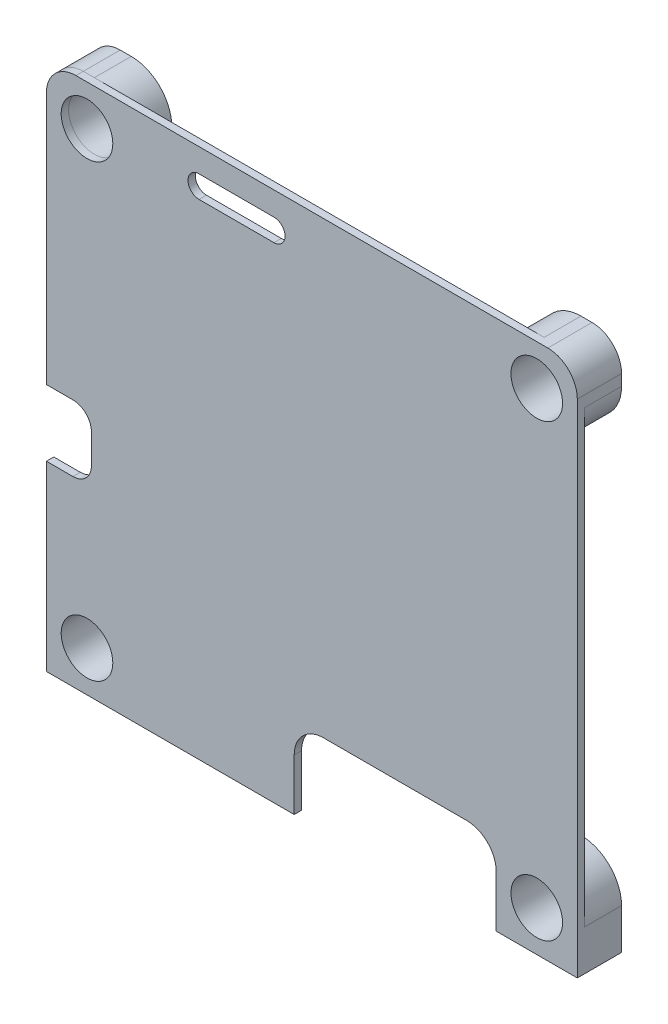
from build123d import *

# Parameters (mm, degrees)
SKETCH2_R         = 1.75
STANDOFFS_DEPTH   = 2.5
STANDOFFS_2_DEPTH = 2.5
STANDOFFS_3_DEPTH = 2.5
STANDOFFS_4_DEPTH = 2.5
SKETCH3_R         = 1.75
COVER_DEPTH       = 0.5
FILLETS_R         = 2


with BuildPart() as part:
    # Sketch2 → Standoffs (new body)
    with BuildSketch(Plane.XY):
        with BuildLine():
            Line((18, -18), (18, -15.25))
            ThreePointArc((18, -15.25), (15.25, -12.5), (12.5, -15.25))
            Line((12.5, -15.25), (12.5, -18))
            Line((12.5, -18), (18, -18))
        make_face()
        with Locations((15.25, -15.25)):
            Circle(SKETCH2_R, mode=Mode.SUBTRACT)
    extrude(amount=STANDOFFS_DEPTH)



with BuildPart() as body_2:
    # Sketch2 → Standoffs 2 (new body)
    with BuildSketch(Plane.XY):
        with BuildLine():
            Line((-12.5, -18), (-12.5, -15.25))
            ThreePointArc((-12.5, -15.25), (-15.250000002, -12.5), (-18, -15.250000004))
            Line((-18, -15.250000004), (-18, -18))
            Line((-18, -18), (-12.5, -18))
        make_face()
        with Locations((-15.25, -15.25)):
            Circle(SKETCH2_R, mode=Mode.SUBTRACT)
    extrude(amount=STANDOFFS_2_DEPTH)


with BuildPart() as body_3:
    # Sketch2 → Standoffs 3 (new body)
    with BuildSketch(Plane.XY):
        with BuildLine():
            Line((16, 18), (15.25, 18))
            ThreePointArc((15.25, 18), (13.305456352, 13.305456352), (18, 15.25))
            Line((18, 15.25), (18, 16))
            ThreePointArc((18, 16), (17.414213562, 17.414213562), (16, 18))
        make_face()
        with Locations((15.25, 15.25)):
            Circle(SKETCH2_R, mode=Mode.SUBTRACT)
    extrude(amount=STANDOFFS_3_DEPTH)


with BuildPart() as body_4:
    # Sketch2 → Standoffs 4 (new body)
    with BuildSketch(Plane.XY):
        with BuildLine():
            Line((-18, 16), (-18, 15.25))
            ThreePointArc((-18, 15.25), (-13.305456377, 13.305456326), (-15.249999928, 18))
            Line((-15.249999928, 18), (-16, 18))
            ThreePointArc((-16, 18), (-17.414213562, 17.414213562), (-18, 16))
        make_face()
        with Locations((-15.25, 15.25)):
            Circle(SKETCH2_R, mode=Mode.SUBTRACT)
    extrude(amount=STANDOFFS_4_DEPTH)


with BuildPart() as part_1:
    add(part.part)

    add(body_3.part)  # Cover merges body 3

    add(body_2.part)  # Cover merges body 2
    # Sketch3 → Cover (add)
    with BuildSketch(Plane.XY.offset(2.5)):
        with BuildLine():
            Line((-18, -5.65), (-18, -18))
            Line((-18, -18), (-1.2, -18))
            Line((-1.2, -18), (-1.2, -12.5))
            Line((-1.2, -12.5), (12.5, -12.5))
            Line((12.5, -12.5), (12.5, -18))
            Line((12.5, -18), (18, -18))
            Line((18, -18), (18, 16))
            ThreePointArc((18, 16), (17.414213562, 17.414213562), (16, 18))
            Line((16, 18), (-16, 18))
            ThreePointArc((-16, 18), (-17.414213562, 17.414213562), (-18, 16))
            Line((-18, 16), (-18, -1.15))
            Line((-18, -1.15), (-16.2, -1.15))
            ThreePointArc((-16.2, -1.15), (-15.316116524, -1.516116524), (-14.95, -2.4))
            Line((-14.95, -2.4), (-14.95, -4.4))
            ThreePointArc((-14.95, -4.4), (-15.316116524, -5.283883476), (-16.2, -5.65))
            Line((-16.2, -5.65), (-18, -5.65))
        make_face()
        with Locations((-15.25, -15.25)):
            Circle(SKETCH3_R, mode=Mode.SUBTRACT)
        with BuildLine():
            ThreePointArc((-7.65, 14.9), (-8.4, 15.65), (-7.65, 16.4))
            Line((-7.65, 16.4), (-2.57, 16.4))
            ThreePointArc((-2.57, 16.4), (-1.82, 15.65), (-2.57, 14.9))
            Line((-2.57, 14.9), (-7.65, 14.9))
        make_face(mode=Mode.SUBTRACT)
        with Locations((-15.25, 15.25)):
            Circle(SKETCH3_R, mode=Mode.SUBTRACT)
        with Locations((15.25, -15.25)):
            Circle(SKETCH3_R, mode=Mode.SUBTRACT)
        with Locations((15.25, 15.25)):
            Circle(SKETCH3_R, mode=Mode.SUBTRACT)
    extrude(amount=COVER_DEPTH)

    # Fillets
    fillets_edges = [part_1.edges().sort_by_distance(p)[0] for p in [
        (-1.2, -12.5, 2.75),
        (12.5, -12.5, 2.75),
    ]]
    fillet(fillets_edges, radius=FILLETS_R)


solid = Compound([body_4.part, part_1.part])
